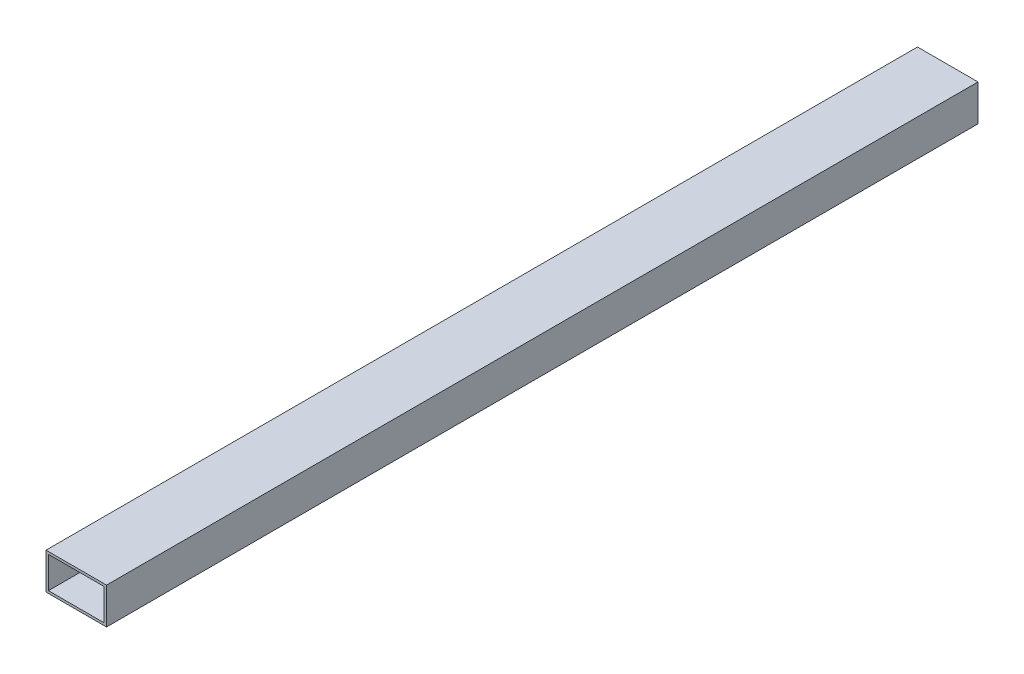
from build123d import *

# Parameters (mm, degrees)
SKETCH1_W           = 50
SKETCH1_H           = 30
SKETCH1_W_2         = 46
SKETCH1_H_2         = 26
BOSS_EXTRUDE1_DEPTH = 360


with BuildPart() as part:
    # Sketch1 → Boss-Extrude1 (new, symmetric)
    with BuildSketch(Plane.XY):
        Rectangle(SKETCH1_W, SKETCH1_H)
        Rectangle(SKETCH1_W_2, SKETCH1_H_2, mode=Mode.SUBTRACT)
    extrude(amount=BOSS_EXTRUDE1_DEPTH, both=True)


solid = part.part
